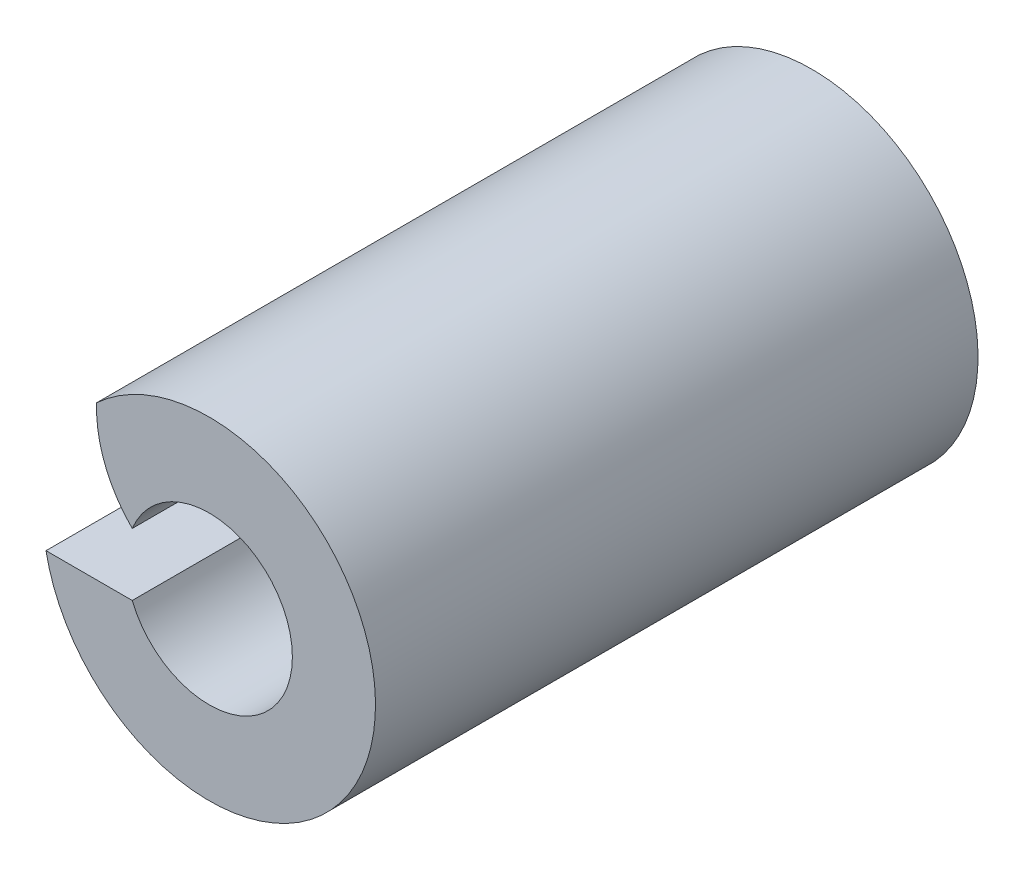
from build123d import *

# Parameters (mm, degrees)
BOSS_EXTRUDE1_DEPTH = 29
CUT_EXTRUDE1_START  = -29
CUT_EXTRUDE1_DEPTH  = 29


with BuildPart() as part:
    # Sketch1 → Boss-Extrude1 (new body)
    with BuildSketch(Plane.XY.offset(-307.252727895)):
        with BuildLine():
            Line((-0.182693347, -19.436221023), (-4.332710926, -19.436221023))
            ThreePointArc((-4.332710926, -19.436221023), (11.525405897, -20.936221023), (-4.332710926, -22.436221023))
            Line((-4.332710926, -22.436221023), (-0.182693347, -22.436221023))
            ThreePointArc((-0.182693347, -22.436221023), (7.525405896, -20.936221023), (-0.182693347, -19.436221023))
        make_face()
    extrude(amount=BOSS_EXTRUDE1_DEPTH)

    # Sketch2 → Cut-Extrude1 (cut)
    with BuildSketch(Plane.XY.offset(-278.252727895).offset(CUT_EXTRUDE1_START)):
        with BuildLine():
            Line((-0.182693347, -19.436221023), (-4.332710926, -19.436221023))
            ThreePointArc((-4.332710926, -19.436221023), (-3.4660308, -17.047800658), (-1.894123767, -15.051605638))
            ThreePointArc((-1.894123767, -15.051605638), (-1.497962981, -17.423289479), (-0.182693347, -19.436221023))
        make_face()
    extrude(amount=CUT_EXTRUDE1_DEPTH, mode=Mode.SUBTRACT)


solid = part.part
